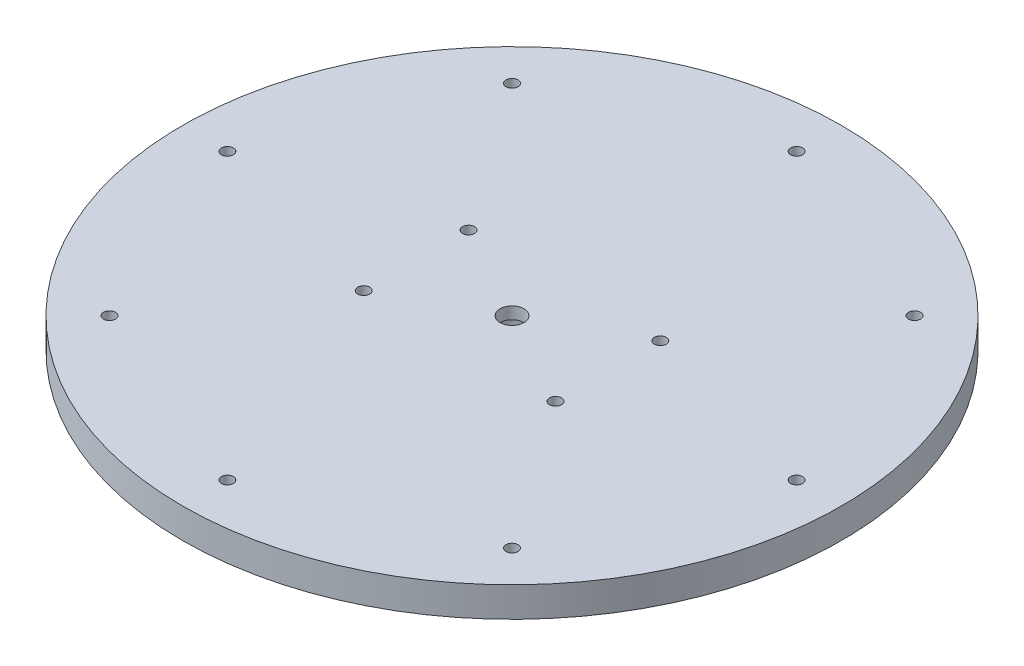
from build123d import *

# Parameters (mm, degrees)
SKETCH2_R           = 110
BOSS_EXTRUDE2_DEPTH = 10
SKETCH4_R           = 9.5
CUT_EXTRUDE1_DEPTH  = 6
SKETCH6_R           = 4
CUT_EXTRUDE3_DEPTH  = 156.679157243
SKETCH7_R           = 2
CUT_EXTRUDE6_DEPTH  = 156.884572681
SKETCH8_R           = 2
CUT_EXTRUDE7_DEPTH  = 10


with BuildPart() as part:
    # Sketch2 → Boss-Extrude2 (new body)
    with BuildSketch(Plane(origin=(0, 0, 0), x_dir=(1, 0, 0), z_dir=(0, 1, 0))):
        with Locations(Location((0, 0, 0), (0, 0, 270))):
            Circle(SKETCH2_R)
    extrude(amount=BOSS_EXTRUDE2_DEPTH)

    # Sketch4 → Cut-Extrude1 (cut)
    with BuildSketch(Plane(origin=(0, 0, 0), x_dir=(-1, 0, 0), z_dir=(0, -1, 0))):
        with Locations(Location((0, 0, 0), (0, 0, 90))):
            Circle(SKETCH4_R)
    extrude(amount=-CUT_EXTRUDE1_DEPTH, mode=Mode.SUBTRACT)

    # Sketch6 → Cut-Extrude3 (cut, through all)
    with BuildSketch(Plane(origin=(0, 6, 0), x_dir=(-1, 0, 0), z_dir=(0, -1, 0))):
        with Locations(Location((0, 0, 0), (0, 0, 90))):
            Circle(SKETCH6_R)
    extrude(amount=-CUT_EXTRUDE3_DEPTH, mode=Mode.SUBTRACT)

    # Sketch7 → Cut-Extrude6 (cut, through all)
    with BuildSketch(Plane(origin=(0, 0, 0), x_dir=(-1, 0, 0), z_dir=(0, -1, 0))):
        with Locations(Location((32, -17.5, 0), (0, 0, 90))):
            Circle(SKETCH7_R)
        with Locations(Location((32, 17.5, 0), (0, 0, 90))):
            Circle(SKETCH7_R)
        with Locations(Location((-32, 17.5, 0), (0, 0, 90))):
            Circle(SKETCH7_R)
        with Locations(Location((-32, -17.5, 0), (0, 0, 90))):
            Circle(SKETCH7_R)
    extrude(amount=-CUT_EXTRUDE6_DEPTH, mode=Mode.SUBTRACT)

    # Sketch8 → Cut-Extrude7 (cut)
    with BuildSketch(Plane.XZ):
        with Locations(Location((0, 95, 0), (0, 0, 270))):
            Circle(SKETCH8_R)
        with Locations(Location((67.175144213, 67.175144213, 0), (0, 0, 270))):
            Circle(SKETCH8_R)
        with Locations(Location((95, 0, 0), (0, 0, 270))):
            Circle(SKETCH8_R)
        with Locations(Location((67.175144213, -67.175144213, 0), (0, 0, 270))):
            Circle(SKETCH8_R)
        with Locations(Location((0, -95, 0), (0, 0, 270))):
            Circle(SKETCH8_R)
        with Locations(Location((-67.175144213, -67.175144213, 0), (0, 0, 270))):
            Circle(SKETCH8_R)
        with Locations(Location((-95, 0, 0), (0, 0, 270))):
            Circle(SKETCH8_R)
        with Locations(Location((-67.175144213, 67.175144213, 0), (0, 0, 270))):
            Circle(SKETCH8_R)
    extrude(amount=-CUT_EXTRUDE7_DEPTH, mode=Mode.SUBTRACT)


solid = part.part
